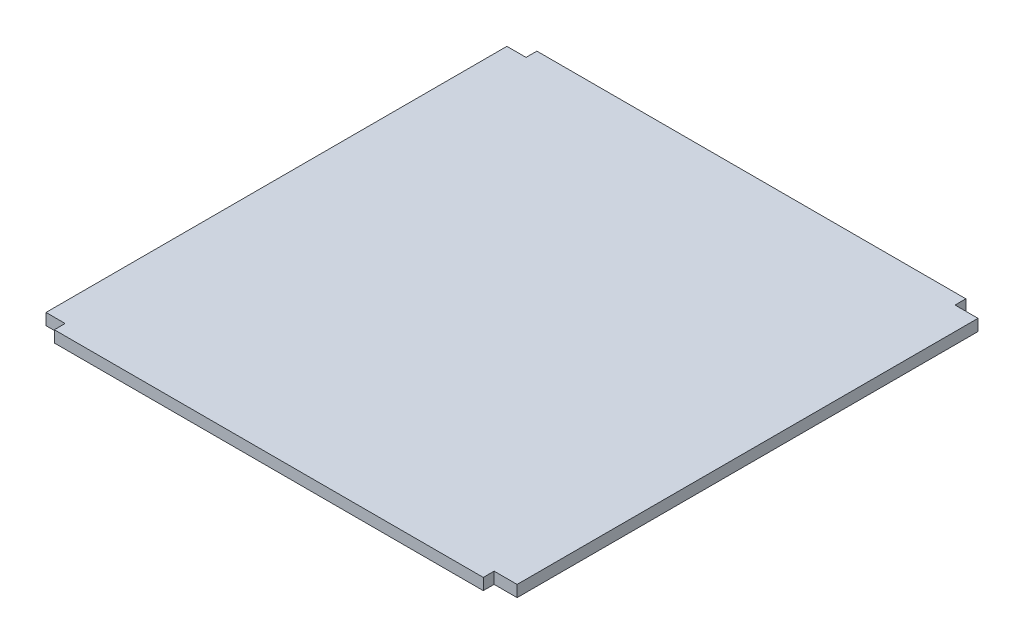
from build123d import *

# Parameters (mm, degrees)
BOSS_EXTRUDE1_DEPTH = 1.5


with BuildPart() as part:
    # Sketch1 → Boss-Extrude1 (new body)
    with BuildSketch(Plane(origin=(0, 0, 0), x_dir=(1, 0, 0), z_dir=(0, 1, 0))):
        Polygon((0, 1.415), (0, 61.585), (2.5, 61.585), (2.5, 63), (58.5, 63), (58.5, 61.585), (61.5, 61.585), (61.5, 1.415), (58.5, 1.415), (58.5, 0), (2.5, 0), (2.5, 1.415), align=None)
    extrude(amount=BOSS_EXTRUDE1_DEPTH)


solid = part.part
